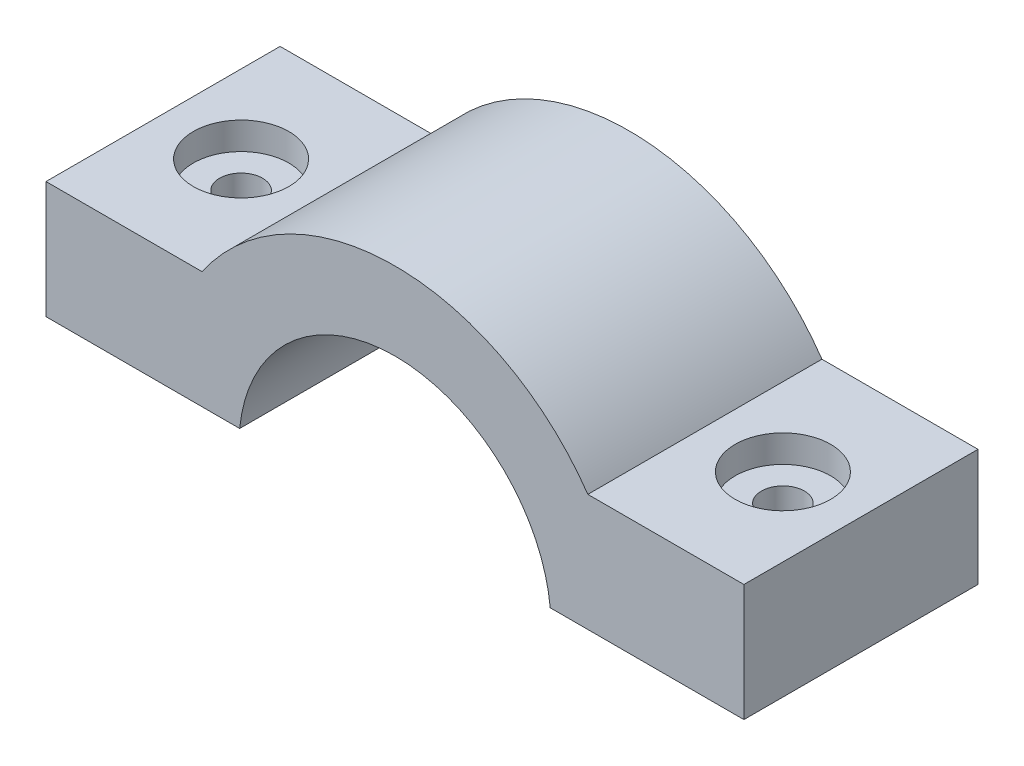
from build123d import *

# Parameters (mm, degrees)
BOSS_EXTRU_1_DEPTH                                 = 15
CHAMBRAGE_POUR_VIS_T_TE_HEXAGONALE_M51_D           = 5.5
CHAMBRAGE_POUR_VIS_T_TE_HEXAGONALE_M51_CBORE_D     = 12.238
CHAMBRAGE_POUR_VIS_T_TE_HEXAGONALE_M51_CBORE_DEPTH = 3.5


with BuildPart() as part:
    # Esquisse1 → Boss.-Extru.1 (new, symmetric)
    with BuildSketch(Plane.XY):
        with BuildLine():
            Line((42.664695124, -2.070799618), (67.48336057, -2.070799618))
            ThreePointArc((67.48336057, -2.070799618), (87.383109312, 15.929200382), (107.282858055, -2.070799618))
            Line((107.282858055, -2.070799618), (132.101523501, -2.070799618))
            Line((132.101523501, -2.070799618), (132.101523501, 12.929200382))
            Line((132.101523501, 12.929200382), (112.101523501, 12.929200382))
            ThreePointArc((112.101523501, 12.929200382), (87.383109312, 25.929200382), (62.664695124, 12.929200382))
            Line((62.664695124, 12.929200382), (42.664695124, 12.929200382))
            Line((42.664695124, 12.929200382), (42.664695124, -2.070799618))
        make_face()
    extrude(amount=BOSS_EXTRU_1_DEPTH, both=True)

    # Chambrage pour vis à tête hexagonale M51 (through all)
    with Locations(Plane(origin=(52.664695124, 12.929200382, 0), x_dir=(0, 0, 1), z_dir=(0, 1, 0))):
        with Locations((0, 0), (0, 69.436828377)):
            CounterBoreHole(CHAMBRAGE_POUR_VIS_T_TE_HEXAGONALE_M51_D / 2, CHAMBRAGE_POUR_VIS_T_TE_HEXAGONALE_M51_CBORE_D / 2, CHAMBRAGE_POUR_VIS_T_TE_HEXAGONALE_M51_CBORE_DEPTH)


solid = part.part
